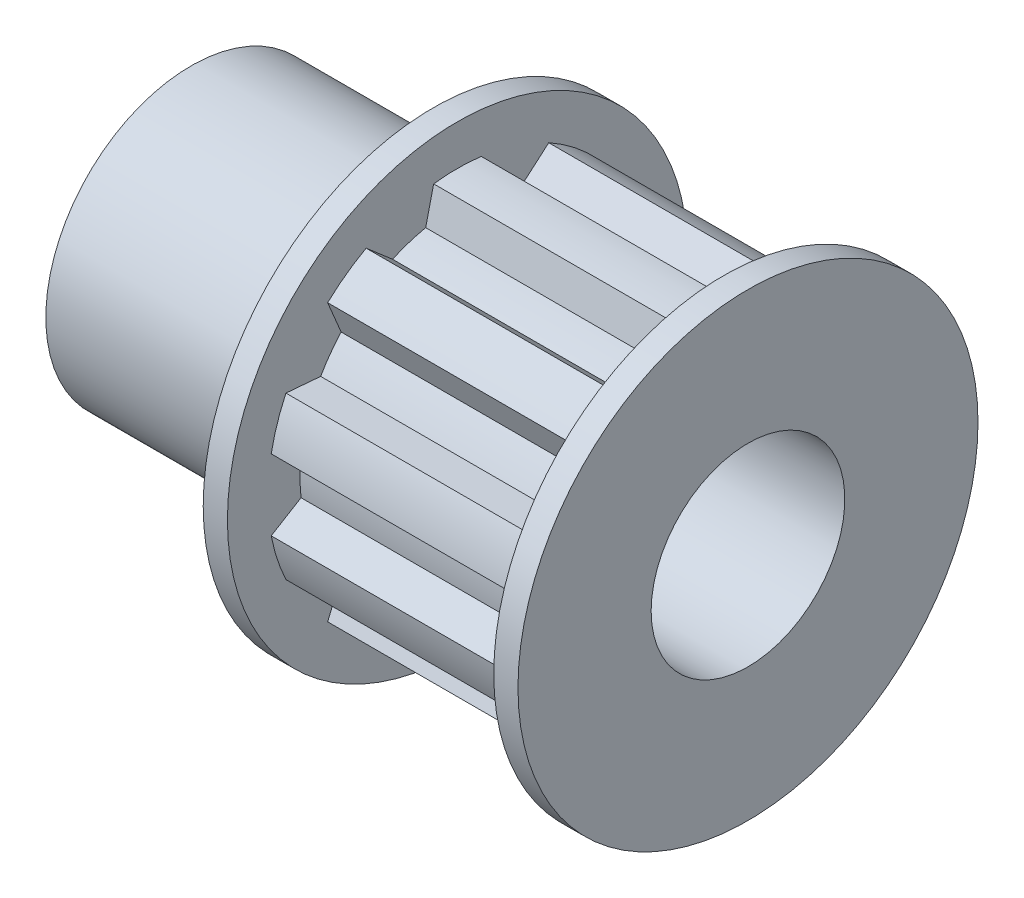
from build123d import *

# Parameters (mm, degrees)
SKETCH1_R           = 6
BOSS_EXTRUDE1_DEPTH = 10
SKETCH2_R           = 9.5
BOSS_EXTRUDE2_DEPTH = 1
BOSS_EXTRUDE3_DEPTH = 11
SKETCH4_R           = 9.5
BOSS_EXTRUDE4_DEPTH = 1
SKETCH5_R           = 4
CUT_EXTRUDE1_DEPTH  = 27.636441204
SKETCH6_R           = 2
CUT_EXTRUDE2_DEPTH  = 27.636441204


with BuildPart() as part:
    # Sketch1 → Boss-Extrude1 (new body)
    with BuildSketch(Plane(origin=(0, 0, 0), x_dir=(0, 0, -1), z_dir=(1, 0, 0))):
        Circle(SKETCH1_R)
    extrude(amount=BOSS_EXTRUDE1_DEPTH)

    # Sketch2 → Boss-Extrude2 (add)
    with BuildSketch(Plane(origin=(10, 0, 0), x_dir=(0, 0, -1), z_dir=(1, 0, 0))):
        Circle(SKETCH2_R)
    extrude(amount=BOSS_EXTRUDE2_DEPTH)

    # Sketch3 → Boss-Extrude3 (add)
    with BuildSketch(Plane(origin=(11, 0, 0), x_dir=(0, 0, -1), z_dir=(1, 0, 0))):
        with BuildLine():
            Line((-0.982460567, 7.768118899), (-1.311725835, 6.366268557))
            ThreePointArc((-1.311725835, 6.366268557), (-2.008610463, 6.181867356), (-2.680790278, 5.921432554))
            Line((-2.680790278, 5.921432554), (-3.771158432, 6.862016036))
            ThreePointArc((-3.771158432, 6.862016036), (-4.602358525, 6.334603066), (-5.360813022, 5.707064372))
            Line((-5.360813022, 5.707064372), (-4.803207262, 4.379406352))
            ThreePointArc((-4.803207262, 4.379406352), (-5.258610463, 3.82060414), (-5.64933562, 3.214810577))
            Line((-5.64933562, 3.214810577), (-7.084323087, 3.334856278))
            ThreePointArc((-7.084323087, 3.334856278), (-7.446772523, 2.419603066), (-7.69151711, 1.46610523))
            Line((-7.69151711, 1.46610523), (-6.46002677, 0.719759772))
            ThreePointArc((-6.46002677, 0.719759772), (-6.5, 0), (-6.46002677, -0.719759772))
            Line((-6.46002677, -0.719759772), (-7.69151711, -1.46610523))
            ThreePointArc((-7.69151711, -1.46610523), (-7.446772523, -2.419603066), (-7.084323087, -3.334856278))
            Line((-7.084323087, -3.334856278), (-5.64933562, -3.214810577))
            ThreePointArc((-5.64933562, -3.214810577), (-5.258610463, -3.82060414), (-4.803207262, -4.379406352))
            Line((-4.803207262, -4.379406352), (-5.360813022, -5.707064372))
            ThreePointArc((-5.360813022, -5.707064372), (-4.602358525, -6.334603066), (-3.771158432, -6.862016036))
            Line((-3.771158432, -6.862016036), (-2.680790278, -5.921432554))
            ThreePointArc((-2.680790278, -5.921432554), (-2.008610463, -6.181867356), (-1.311725835, -6.366268557))
            Line((-1.311725835, -6.366268557), (-0.982460567, -7.768118899))
            ThreePointArc((-0.982460567, -7.768118899), (0, -7.83), (0.982460567, -7.768118899))
            Line((0.982460567, -7.768118899), (1.311725835, -6.366268557))
            ThreePointArc((1.311725835, -6.366268557), (2.008610463, -6.181867356), (2.680790278, -5.921432554))
            Line((2.680790278, -5.921432554), (3.771158432, -6.862016036))
            ThreePointArc((3.771158432, -6.862016036), (4.602358525, -6.334603066), (5.360813022, -5.707064372))
            Line((5.360813022, -5.707064372), (4.803207262, -4.379406352))
            ThreePointArc((4.803207262, -4.379406352), (5.258610463, -3.82060414), (5.64933562, -3.214810577))
            Line((5.64933562, -3.214810577), (7.084323087, -3.334856278))
            ThreePointArc((7.084323087, -3.334856278), (7.446772523, -2.419603066), (7.69151711, -1.46610523))
            Line((7.69151711, -1.46610523), (6.46002677, -0.719759772))
            ThreePointArc((6.46002677, -0.719759772), (6.5, 0), (6.46002677, 0.719759772))
            Line((6.46002677, 0.719759772), (7.69151711, 1.46610523))
            ThreePointArc((7.69151711, 1.46610523), (7.446772523, 2.419603066), (7.084323087, 3.334856278))
            Line((7.084323087, 3.334856278), (5.64933562, 3.214810577))
            ThreePointArc((5.64933562, 3.214810577), (5.258610463, 3.82060414), (4.803207262, 4.379406352))
            Line((4.803207262, 4.379406352), (5.360813022, 5.707064372))
            ThreePointArc((5.360813022, 5.707064372), (4.602358525, 6.334603066), (3.771158432, 6.862016036))
            Line((3.771158432, 6.862016036), (2.680790278, 5.921432554))
            ThreePointArc((2.680790278, 5.921432554), (2.008610463, 6.181867356), (1.311725835, 6.366268557))
            Line((1.311725835, 6.366268557), (0.982460567, 7.768118899))
            ThreePointArc((0.982460567, 7.768118899), (0, 7.83), (-0.982460567, 7.768118899))
        make_face()
    extrude(amount=BOSS_EXTRUDE3_DEPTH)

    # Sketch4 → Boss-Extrude4 (add)
    with BuildSketch(Plane(origin=(22, 0, 0), x_dir=(0, 0, -1), z_dir=(1, 0, 0))):
        Circle(SKETCH4_R)
    extrude(amount=BOSS_EXTRUDE4_DEPTH)

    # Sketch5 → Cut-Extrude1 (cut, through all)
    with BuildSketch(Plane.ZY):
        Circle(SKETCH5_R)
    extrude(amount=-CUT_EXTRUDE1_DEPTH, mode=Mode.SUBTRACT)

    # Sketch6 → Cut-Extrude2 (cut, through all)
    with BuildSketch(Plane(origin=(0, 0, 0), x_dir=(1, 0, 0), z_dir=(0, 1, 0))):
        with Locations(Location((5, 0, 0), (0, 0, 270))):
            Circle(SKETCH6_R)
    extrude(amount=-CUT_EXTRUDE2_DEPTH, mode=Mode.SUBTRACT)


solid = part.part
